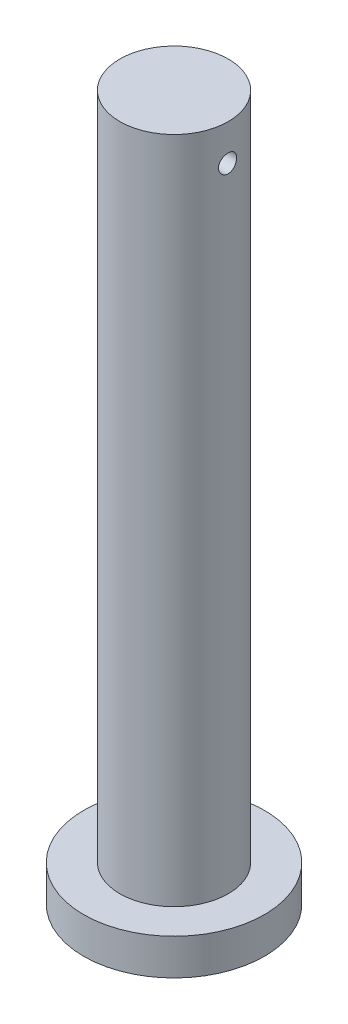
from build123d import *

# Parameters (mm, degrees)
SKETCH1_R           = 25
BOSS_EXTRUDE1_DEPTH = 10
SKETCH2_R           = 15
BOSS_EXTRUDE2_DEPTH = 185
SKETCH3_R           = 2.5
CUT_EXTRUDE1_DEPTH  = 92.5


with BuildPart() as part:
    # Sketch1 → Boss-Extrude1 (new body)
    with BuildSketch(Plane(origin=(0, 0, 0), x_dir=(1, 0, 0), z_dir=(0, 1, 0))):
        with Locations(Location((0, 0, 0), (0, 0, 270))):
            Circle(SKETCH1_R)
    extrude(amount=BOSS_EXTRUDE1_DEPTH)

    # Sketch2 → Boss-Extrude2 (add)
    with BuildSketch(Plane(origin=(0, 10, 0), x_dir=(1, 0, 0), z_dir=(0, 1, 0))):
        with Locations(Location((0, 0, 0), (0, 0, 270))):
            Circle(SKETCH2_R)
    extrude(amount=BOSS_EXTRUDE2_DEPTH)

    # Sketch3 → Cut-Extrude1 (cut, symmetric)
    with BuildSketch(Plane(origin=(0, 0, 0), x_dir=(0, 0, -1), z_dir=(1, 0, 0))):
        with Locations((0, 185)):
            Circle(SKETCH3_R)
    extrude(amount=CUT_EXTRUDE1_DEPTH, both=True, mode=Mode.SUBTRACT)


solid = part.part
